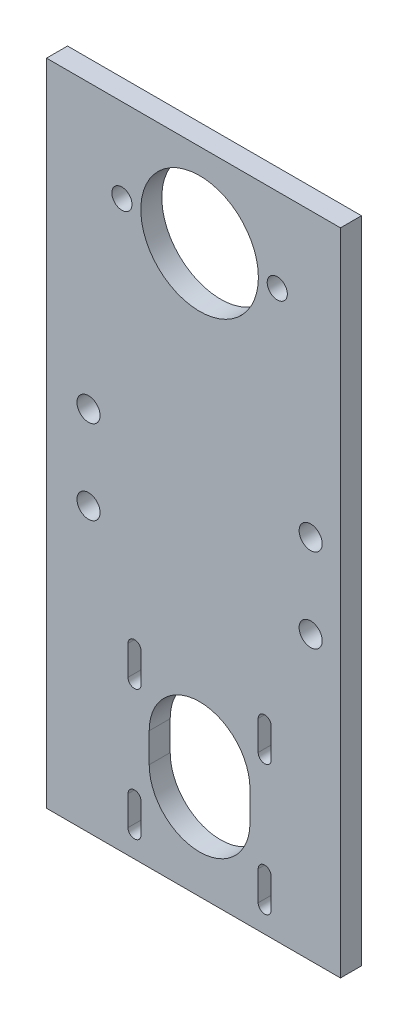
from build123d import *

# Parameters (mm, degrees)
SKETCH1_W           = 70
SKETCH1_H           = 154.713144252
SKETCH1_R           = 2.4
SKETCH1_R_2         = 2.75
SKETCH1_R_3         = 14
BOSS_EXTRUDE1_DEPTH = 5


with BuildPart() as part:
    # Sketch1 → Boss-Extrude1 (new body)
    with BuildSketch(Plane.XY):
        with Locations((-1.450472168, 0)):
            Rectangle(SKETCH1_W, SKETCH1_H)
        with Locations((-18.5, 57.356572126)):
            Circle(SKETCH1_R, mode=Mode.SUBTRACT)
        with Locations((18.5, 57.356572126)):
            Circle(SKETCH1_R, mode=Mode.SUBTRACT)
        with Locations((-26.450472168, 10)):
            Circle(SKETCH1_R_2, mode=Mode.SUBTRACT)
        with Locations((26.450472168, 10)):
            Circle(SKETCH1_R_2, mode=Mode.SUBTRACT)
        with Locations((26.450472168, -10)):
            Circle(SKETCH1_R_2, mode=Mode.SUBTRACT)
        with Locations((-26.450472168, -10)):
            Circle(SKETCH1_R_2, mode=Mode.SUBTRACT)
        with Locations((0, 57.356572126)):
            Circle(SKETCH1_R_3, mode=Mode.SUBTRACT)
        with BuildLine():
            Line((-13.95, -33.643427874), (-13.95, -40.643427874))
            ThreePointArc((-13.95, -40.643427874), (-15.5, -42.193427874), (-17.05, -40.643427874))
            Line((-17.05, -40.643427874), (-17.05, -33.643427874))
            ThreePointArc((-17.05, -33.643427874), (-15.5, -32.093427874), (-13.95, -33.643427874))
        make_face(mode=Mode.SUBTRACT)
        with BuildLine():
            Line((17.05, -33.643427874), (17.05, -40.643427874))
            ThreePointArc((17.05, -40.643427874), (15.5, -42.193427874), (13.95, -40.643427874))
            Line((13.95, -40.643427874), (13.95, -33.643427874))
            ThreePointArc((13.95, -33.643427874), (15.5, -32.093427874), (17.05, -33.643427874))
        make_face(mode=Mode.SUBTRACT)
        with BuildLine():
            Line((17.05, -64.643427874), (17.05, -71.643427874))
            ThreePointArc((17.05, -71.643427874), (15.5, -73.193427874), (13.95, -71.643427874))
            Line((13.95, -71.643427874), (13.95, -64.643427874))
            ThreePointArc((13.95, -64.643427874), (15.5, -63.093427874), (17.05, -64.643427874))
        make_face(mode=Mode.SUBTRACT)
        with BuildLine():
            Line((-13.95, -64.643427874), (-13.95, -71.643427874))
            ThreePointArc((-13.95, -71.643427874), (-15.5, -73.193427874), (-17.05, -71.643427874))
            Line((-17.05, -71.643427874), (-17.05, -64.643427874))
            ThreePointArc((-17.05, -64.643427874), (-15.5, -63.093427874), (-13.95, -64.643427874))
        make_face(mode=Mode.SUBTRACT)
        with BuildLine():
            Line((-12, -56.143427874), (-12, -49.143427874))
            ThreePointArc((-12, -49.143427874), (0, -37.143427874), (12, -49.143427874))
            Line((12, -49.143427874), (12, -56.143427874))
            ThreePointArc((12, -56.143427874), (0, -68.143427874), (-12, -56.143427874))
        make_face(mode=Mode.SUBTRACT)
    extrude(amount=BOSS_EXTRUDE1_DEPTH)


solid = part.part
